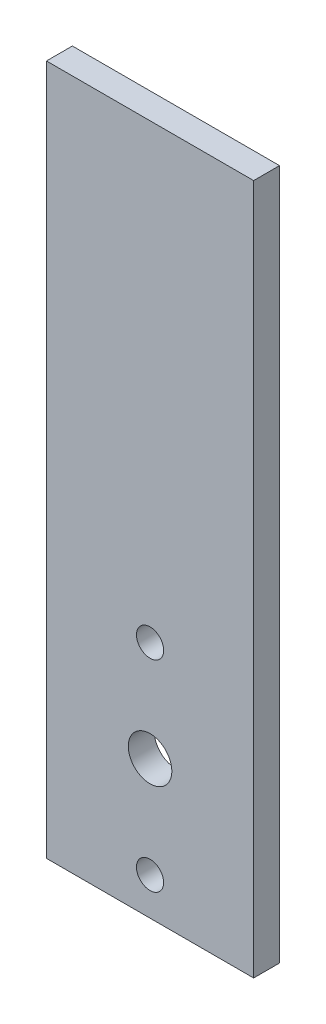
from build123d import *

# Parameters (mm, degrees)
SKETCH1_W           = 38.1
SKETCH1_H           = 127
SKETCH1_R           = 4
SKETCH1_R_2         = 2.5
BOSS_EXTRUDE1_DEPTH = 4.7625


with BuildPart() as part:
    # Sketch1 → Boss-Extrude1 (new body)
    with BuildSketch(Plane.XY):
        with Locations((19.05, 63.5)):
            Rectangle(SKETCH1_W, SKETCH1_H)
        with Locations(Location((19.05, 25.4, 0), (0, 0, 180))):
            Circle(SKETCH1_R, mode=Mode.SUBTRACT)
        with Locations(Location((19.05, 6.9, 0), (0, 0, 180))):
            Circle(SKETCH1_R_2, mode=Mode.SUBTRACT)
        with Locations(Location((19.05, 43.9, 0), (0, 0, 180))):
            Circle(SKETCH1_R_2, mode=Mode.SUBTRACT)
    extrude(amount=BOSS_EXTRUDE1_DEPTH)


solid = part.part
